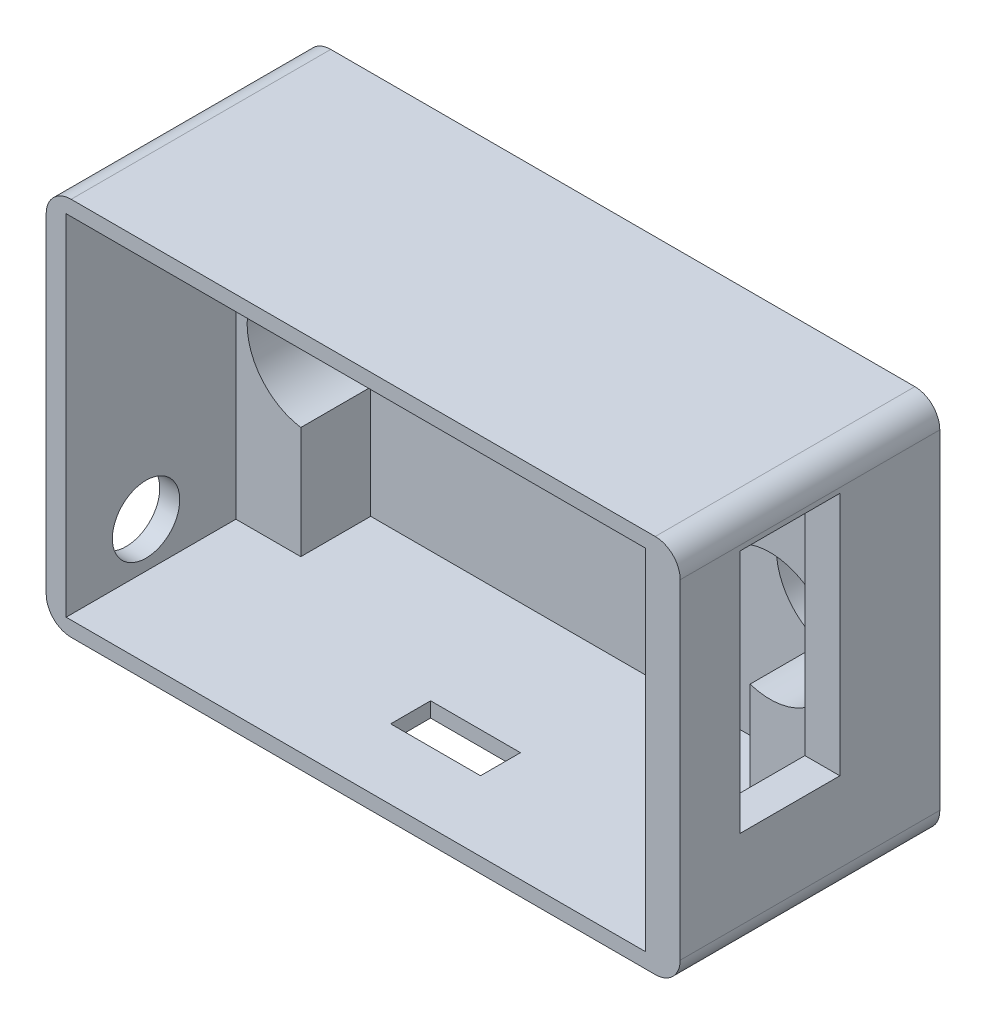
from build123d import *

# Parameters (mm, degrees)
SKETCH1_W           = 63.5
SKETCH1_H           = 38
BOSS_EXTRUDE1_DEPTH = 26
SKETCH2_W           = 58
SKETCH2_H           = 35
CUT_EXTRUDE1_DEPTH  = 17
SKETCH4_W           = 45
SKETCH4_H           = 35
CUT_EXTRUDE3_DEPTH  = 7
SKETCH5_R           = 6.375
CUT_EXTRUDE4_DEPTH  = 9
SKETCH6_W           = 9.989337028
SKETCH6_H           = 24.5
CUT_EXTRUDE5_DEPTH  = 17
SKETCH7_R           = 3.375
CUT_EXTRUDE6_DEPTH  = 7
SKETCH8_W           = 9
SKETCH8_H           = 4
CUT_EXTRUDE7_DEPTH  = 7
FILLET1_R           = 2.5


with BuildPart() as part:
    # Sketch1 → Boss-Extrude1 (new body)
    with BuildSketch(Plane.XY):
        with Locations((31.75, 19)):
            Rectangle(SKETCH1_W, SKETCH1_H)
    extrude(amount=BOSS_EXTRUDE1_DEPTH)

    # Sketch2 → Cut-Extrude1 (cut)
    with BuildSketch(Plane.XY.offset(26)):
        with Locations((31, 19)):
            Rectangle(SKETCH2_W, SKETCH2_H)
    extrude(amount=-CUT_EXTRUDE1_DEPTH, mode=Mode.SUBTRACT)

    # Sketch4 → Cut-Extrude3 (cut)
    with BuildSketch(Plane.XY.offset(9)):
        with Locations((31, 19)):
            Rectangle(SKETCH4_W, SKETCH4_H)
    extrude(amount=-CUT_EXTRUDE3_DEPTH, mode=Mode.SUBTRACT)

    # Sketch5 → Cut-Extrude4 (cut)
    with BuildSketch(Plane(origin=(0, 0, 0), x_dir=(-1, 0, 0), z_dir=(0, 0, -1))):
        with Locations((-55.5, 19)):
            Circle(SKETCH5_R)
        with Locations((-9.5, 19)):
            Circle(SKETCH5_R)
    extrude(amount=-CUT_EXTRUDE4_DEPTH, mode=Mode.SUBTRACT)

    # Sketch6 → Cut-Extrude5 (cut)
    with BuildSketch(Plane(origin=(63.5, 0, 0), x_dir=(0, 0, -1), z_dir=(1, 0, 0))):
        with Locations((-15.005331486, 22.75)):
            Rectangle(SKETCH6_W, SKETCH6_H)
    extrude(amount=-CUT_EXTRUDE5_DEPTH, mode=Mode.SUBTRACT)

    # Sketch7 → Cut-Extrude6 (cut)
    with BuildSketch(Plane.ZY):
        with Locations((18, 6)):
            Circle(SKETCH7_R)
    extrude(amount=-CUT_EXTRUDE6_DEPTH, mode=Mode.SUBTRACT)

    # Sketch8 → Cut-Extrude7 (cut)
    with BuildSketch(Plane.XZ):
        with Locations((32, 17)):
            Rectangle(SKETCH8_W, SKETCH8_H)
    extrude(amount=-CUT_EXTRUDE7_DEPTH, mode=Mode.SUBTRACT)

    # Fillet1
    fillet1_edges = [part.edges().sort_by_distance(p)[0] for p in [
        (0, 38, 13),
        (63.5, 38, 13),
        (63.5, 0, 13),
        (0, 0, 13),
    ]]
    fillet(fillet1_edges, radius=FILLET1_R)


solid = part.part
